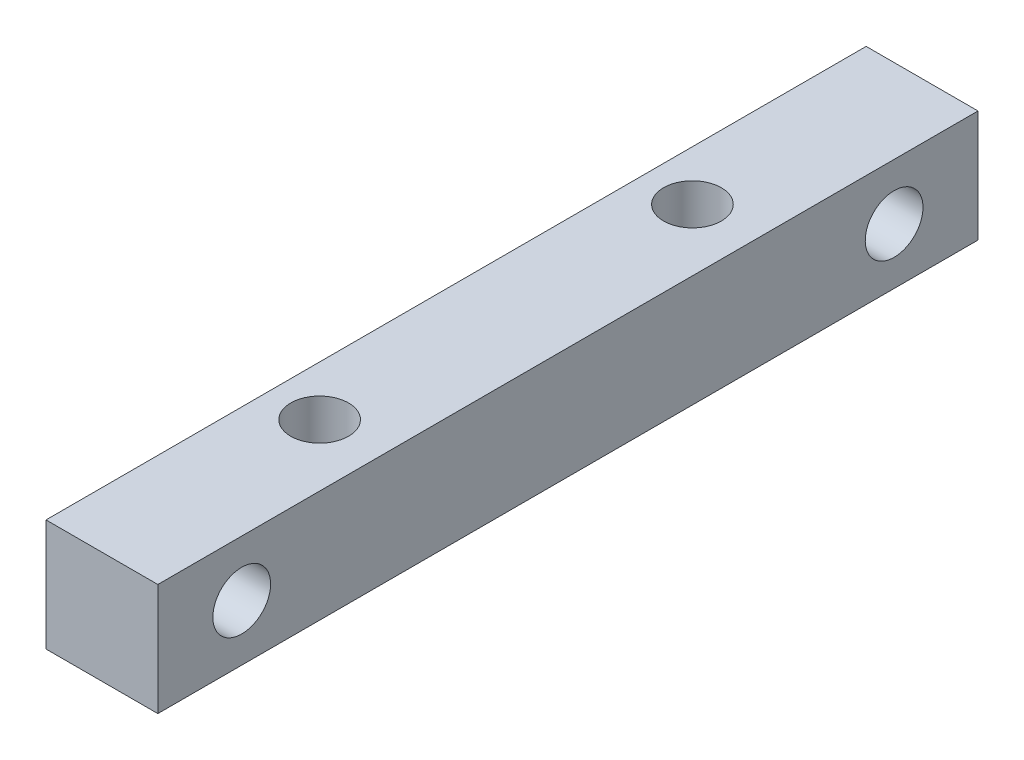
from build123d import *

# Parameters (mm, degrees)
SKETCH_1_W          = 6
SKETCH_1_H          = 6
EXTRUDE_1_DEPTH     = 22
SKETCH_3_R          = 1.55
CUT_EXTRUDE_1_DEPTH = 44
SKETCH_6_R          = 1.55
CUT_EXTRUDE_2_DEPTH = 10


with BuildPart() as part:
    # 草图1 → 凸台-拉伸1 (new, symmetric)
    with BuildSketch(Plane.XY):
        Rectangle(SKETCH_1_W, SKETCH_1_H)
    extrude(amount=EXTRUDE_1_DEPTH, both=True)

    # 草图3 → 切除-拉伸1 (cut)
    with BuildSketch(Plane(origin=(3, 0, 0), x_dir=(0, 0, -1), z_dir=(1, 0, 0))):
        with Locations(Location((-17.5, 0, 0), (0, 0, 90))):
            Circle(SKETCH_3_R)
        with Locations(Location((17.5, 0, 0), (0, 0, 90))):
            Circle(SKETCH_3_R)
    extrude(amount=-CUT_EXTRUDE_1_DEPTH, mode=Mode.SUBTRACT)

    # 草图6 → 切除-拉伸2 (cut)
    with BuildSketch(Plane(origin=(0, 3, 0), x_dir=(1, 0, 0), z_dir=(0, 1, 0))):
        with Locations(Location((-0.320508076, -10, 0), (0, 0, 270))):
            Circle(SKETCH_6_R)
        with Locations(Location((-0.320508076, 10, 0), (0, 0, 270))):
            Circle(SKETCH_6_R)
    extrude(amount=-CUT_EXTRUDE_2_DEPTH, mode=Mode.SUBTRACT)


solid = part.part
